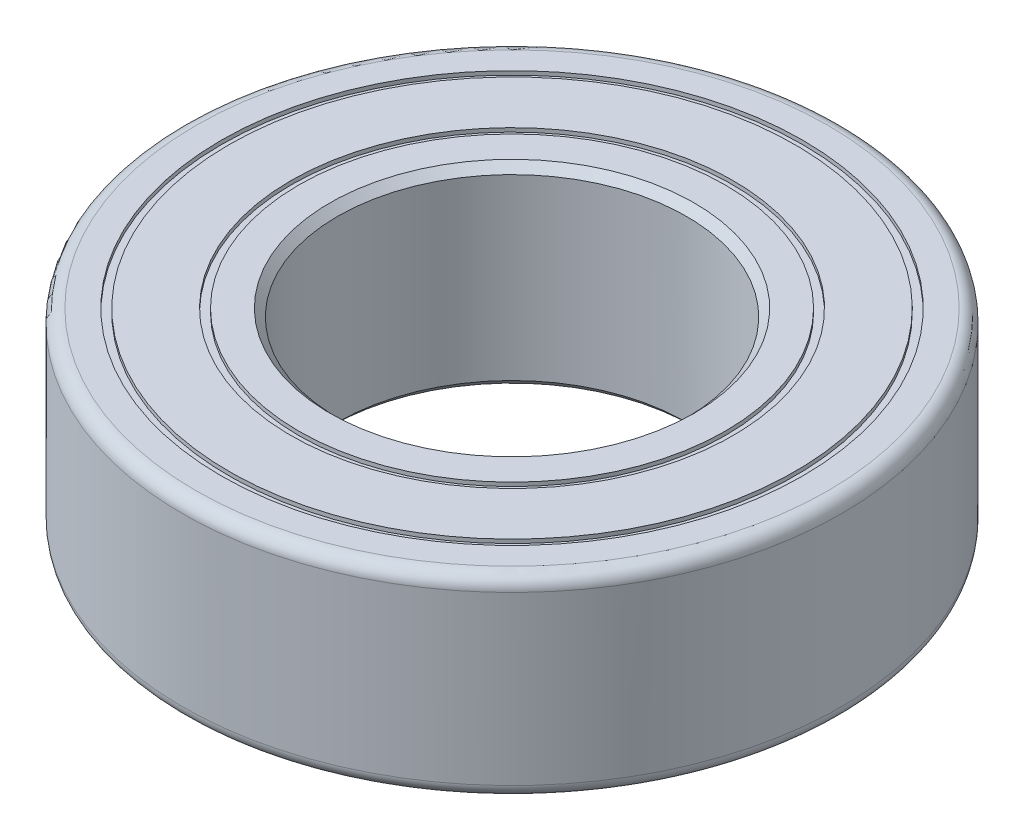
from build123d import *

# Parameters (mm, degrees)
FILLET2_R     = 0.344
CHAMFER2_SIZE = 0.2


with BuildPart() as part:
    # Sketch1 → Revolve1 (revolve)
    with BuildSketch(Plane.XY, mode=Mode.PRIVATE) as revolve1_sk:
        Polygon((8.5, 0), (8.5, 5), (7.5, 5), (7.5, 4.9), (7.3, 4.9), (7.3, 5), (5.7, 5), (5.7, 4.9), (5.5, 4.9), (5.5, 5), (4.5, 5), (4.5, 0), (5.5, 0), (5.5, 0.1), (5.7, 0.1), (5.7, 0), (7.3, 0), (7.3, 0.1), (7.5, 0.1), (7.5, 0), align=None)
    revolve(revolve1_sk.sketch.rotate(Axis((0, 2.5, 0), (0, -1, 0)), 180), axis=Axis((0, 2.5, 0), (0, -1, 0)))

    # Fillet2
    fillet2_edges = [part.edges().sort_by_distance(p)[0] for p in [
        (8.5, 0, 0),
        (8.5, 5, 0),
    ]]
    fillet(fillet2_edges, radius=FILLET2_R)

    # Chamfer2
    chamfer2_edges = [part.edges().sort_by_distance(p)[0] for p in [
        (4.5, 5, 0),
        (4.5, 0, 0),
    ]]
    chamfer(chamfer2_edges, length=CHAMFER2_SIZE)


solid = part.part
